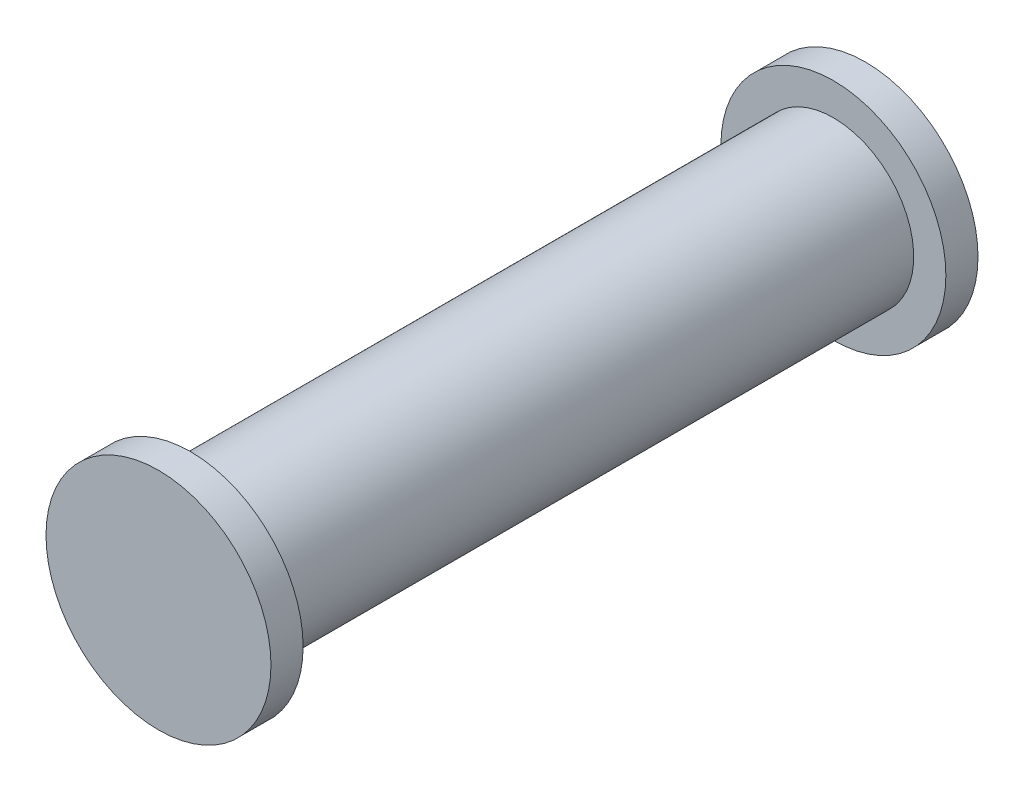
from build123d import *

# Parameters (mm, degrees)
SKETCH_1_R        = 5
EXTRUDE_1_DEPTH   = 42
SKETCH_3_R        = 7
SKETCH_3_R_2      = 5
EXTRUDE_2_DEPTH   = 2
SKETCH_4_R        = 7
SKETCH_4_R_2      = 5
EXTRUDE_4_DEPTH   = 2
SKETCH_5_R        = 5
EXTRUDE_2_2_DEPTH = 2


with BuildPart() as part:
    # 草图1 → 凸台-拉伸1 (new body)
    with BuildSketch(Plane.XY):
        with Locations(Location((0, 0, 0), (0, 0, 180))):
            Circle(SKETCH_1_R)
    extrude(amount=EXTRUDE_1_DEPTH)

    # 草图3 → Extrude 2 (add)
    with BuildSketch(Plane(origin=(0, 0, 0), x_dir=(-1, 0, 0), z_dir=(0, 0, -1))):
        Circle(SKETCH_3_R)
        Circle(SKETCH_3_R_2, mode=Mode.SUBTRACT)
    extrude(amount=-EXTRUDE_2_DEPTH)



with BuildPart() as body_2:
    # 草图4 → 拉伸-薄壁4 (new body)
    with BuildSketch(Plane.XY.offset(42)):
        Circle(SKETCH_4_R)
        Circle(SKETCH_4_R_2, mode=Mode.SUBTRACT)
    extrude(amount=EXTRUDE_4_DEPTH)


with BuildPart() as part_1:
    add(part.part)

    add(body_2.part)  # Extrude 2 2 merges body 2
    # 草图5 → Extrude 2 2 (add)
    with BuildSketch(Plane.XY.offset(42)):
        with Locations(Location((0, 0, 0), (0, 0, 180))):
            Circle(SKETCH_5_R)
    extrude(amount=EXTRUDE_2_2_DEPTH)


solid = part_1.part
